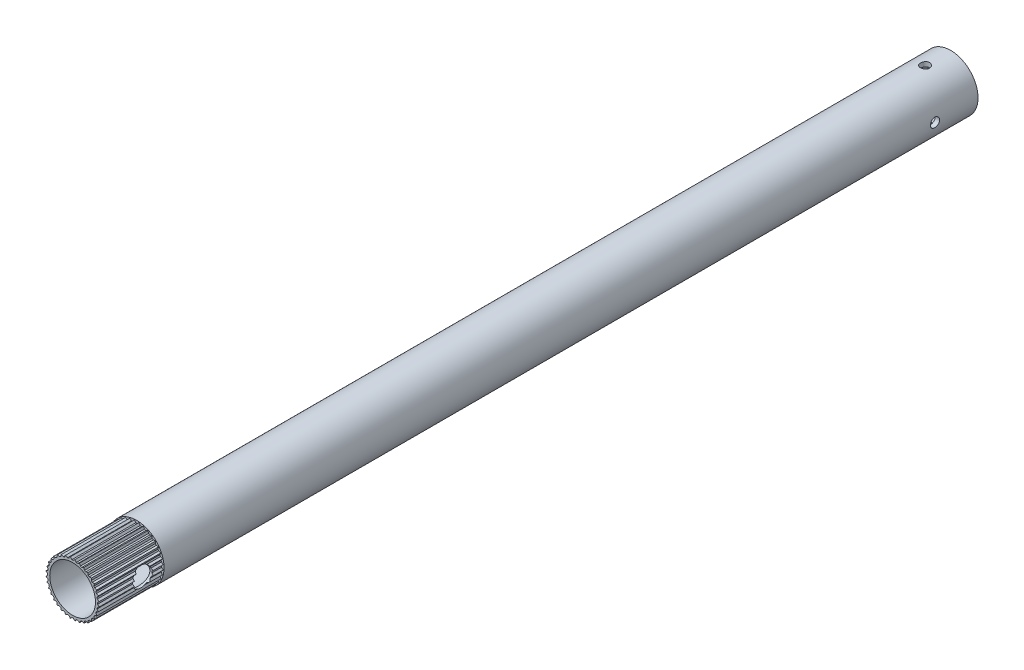
from build123d import *

# Parameters (mm, degrees)
SKETCH5_W               = 1.587499994
SKETCH5_H               = 304.8
CUT_EXTRUDE5_DEPTH      = 330.351514993
CUT_EXTRUDE5_DEPTH_BACK = 330.351514993
SKETCH7_R               = 1.5875
SKETCH7_R_2             = 3.3782
CUT_EXTRUDE6_DEPTH      = 330.351515099
CUT_EXTRUDE6_DEPTH_BACK = 330.351515099
SKETCH6_R               = 1.5875
CUT_EXTRUDE7_START      = 329.075932
SKETCH8_R               = 12.7
CUT_EXTRUDE7_DEPTH      = 22.225


with BuildPart() as part:
    # Sketch5 → Revolve2 (revolve)
    with BuildSketch(Plane(origin=(0, 0, 0), x_dir=(1, 0, 0), z_dir=(0, 1, 0)), mode=Mode.PRIVATE) as revolve2_sk:
        with Locations((8.731249997, -176.675932238)):
            Rectangle(SKETCH5_W, SKETCH5_H)
    revolve(revolve2_sk.sketch.rotate(Axis((0, 0, -2.015669047), (0, 0, 1)), 180), axis=Axis((0, 0, -2.015669047), (0, 0, 1)))

    # Sketch7 → Cut-Extrude5 (cut, two sides: drawn at the far end of the back side and taken through both)
    with BuildSketch(Plane(origin=(0, 0, 0), x_dir=(0, 0, -1), z_dir=(1, 0, 0)).offset(-CUT_EXTRUDE5_DEPTH_BACK)):
        with Locations((-39.195999993, 0)):
            Circle(SKETCH7_R)
        with Locations((-313.582332238, 0)):
            Circle(SKETCH7_R_2)
    extrude(amount=CUT_EXTRUDE5_DEPTH + CUT_EXTRUDE5_DEPTH_BACK, mode=Mode.SUBTRACT)

    # Sketch6 → Cut-Extrude6 (cut, two sides: drawn at the far end of the back side and taken through both)
    with BuildSketch(Plane(origin=(0, 0, 0), x_dir=(1, 0, 0), z_dir=(0, 1, 0)).offset(-CUT_EXTRUDE6_DEPTH_BACK)):
        with Locations(Location((1e-09, -33.163499999, 0), (0, 0, 269.999999955))):
            Circle(SKETCH6_R)
    extrude(amount=CUT_EXTRUDE6_DEPTH + CUT_EXTRUDE6_DEPTH_BACK, mode=Mode.SUBTRACT)

    # Sketch8 → Cut-Extrude7 (cut)
    with BuildSketch(Plane.XY.offset(CUT_EXTRUDE7_START)):
        Circle(SKETCH8_R)
        Polygon((9.235721046, -0.808020891), (8.681700155, -0.254), (8.681700155, 0.254), (9.235721046, 0.808020891), (8.593912259, 1.257420242), (8.505698985, 1.75770258), (8.955098336, 2.399511367), (8.245002688, 2.730634406), (8.071256455, 3.207998257), (8.402379494, 3.918093905), (7.645572882, 4.120879625), (7.391572882, 4.56082053), (7.594358603, 5.317627141), (6.813836213, 5.385914002), (6.487300108, 5.775064579), (6.555586968, 6.555586968), (5.775064579, 6.487300108), (5.385914002, 6.813836213), (5.317627141, 7.594358603), (4.56082053, 7.391572882), (4.120879625, 7.645572882), (3.918093905, 8.402379494), (3.207998257, 8.071256455), (2.730634406, 8.245002688), (2.399511367, 8.955098336), (1.75770258, 8.505698985), (1.257420242, 8.593912259), (0.808020891, 9.235721046), (0.254, 8.681700155), (-0.254, 8.681700155), (-0.808020891, 9.235721046), (-1.257420242, 8.593912259), (-1.75770258, 8.505698985), (-2.399511367, 8.955098336), (-2.730634406, 8.245002688), (-3.207998257, 8.071256455), (-3.918093905, 8.402379494), (-4.120879625, 7.645572882), (-4.56082053, 7.391572882), (-5.317627141, 7.594358603), (-5.385914002, 6.813836213), (-5.775064579, 6.487300108), (-6.555586968, 6.555586968), (-6.487300108, 5.775064579), (-6.813836213, 5.385914002), (-7.594358603, 5.317627141), (-7.391572882, 4.56082053), (-7.645572882, 4.120879625), (-8.402379494, 3.918093905), (-8.071256455, 3.207998257), (-8.245002688, 2.730634406), (-8.955098336, 2.399511367), (-8.505698985, 1.75770258), (-8.593912259, 1.257420242), (-9.235721046, 0.808020891), (-8.681700155, 0.254), (-8.681700155, -0.254), (-9.235721046, -0.808020891), (-8.593912259, -1.257420242), (-8.505698985, -1.75770258), (-8.955098336, -2.399511367), (-8.245002688, -2.730634406), (-8.071256455, -3.207998257), (-8.402379494, -3.918093905), (-7.645572882, -4.120879625), (-7.391572882, -4.56082053), (-7.594358603, -5.317627141), (-6.813836213, -5.385914002), (-6.487300108, -5.775064579), (-6.555586968, -6.555586968), (-5.775064579, -6.487300108), (-5.385914002, -6.813836213), (-5.317627141, -7.594358603), (-4.56082053, -7.391572882), (-4.120879625, -7.645572882), (-3.918093905, -8.402379494), (-3.207998257, -8.071256455), (-2.730634406, -8.245002688), (-2.399511367, -8.955098336), (-1.75770258, -8.505698985), (-1.257420242, -8.593912259), (-0.808020891, -9.235721046), (-0.254, -8.681700155), (0.254, -8.681700155), (0.808020891, -9.235721046), (1.257420242, -8.593912259), (1.75770258, -8.505698985), (2.399511367, -8.955098336), (2.730634406, -8.245002688), (3.207998257, -8.071256455), (3.918093905, -8.402379494), (4.120879625, -7.645572882), (4.56082053, -7.391572882), (5.317627141, -7.594358603), (5.385914002, -6.813836213), (5.775064579, -6.487300108), (6.555586968, -6.555586968), (6.487300108, -5.775064579), (6.813836213, -5.385914002), (7.594358603, -5.317627141), (7.391572882, -4.56082053), (7.645572882, -4.120879625), (8.402379494, -3.918093905), (8.071256455, -3.207998257), (8.245002688, -2.730634406), (8.955098336, -2.399511367), (8.505698985, -1.75770258), (8.593912259, -1.257420242), align=None, mode=Mode.SUBTRACT)
    extrude(amount=-CUT_EXTRUDE7_DEPTH, mode=Mode.SUBTRACT)


solid = part.part
